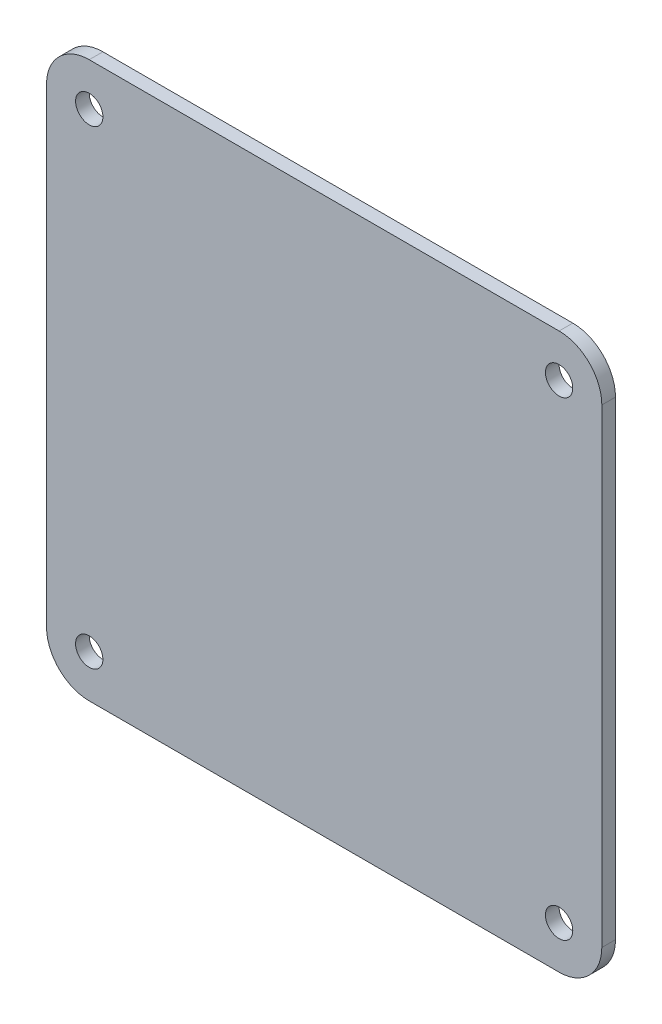
from build123d import *

# Parameters (mm, degrees)
SKETCH_1_W      = 65
SKETCH_1_H      = 65
SKETCH_1_R      = 1.6
EXTRUDE_1_DEPTH = 1.6
FILLET_1_R      = 5


with BuildPart() as part:
    # ｽｹｯﾁ1 → ﾎﾞｽ - 押し出し1 (new body)
    with BuildSketch(Plane.XY):
        Rectangle(SKETCH_1_W, SKETCH_1_H)
        with Locations((-27.5, 27.5)):
            Circle(SKETCH_1_R, mode=Mode.SUBTRACT)
        with Locations(Location((27.5, 27.5, 0), (0, 0, 180))):
            Circle(SKETCH_1_R, mode=Mode.SUBTRACT)
        with Locations(Location((-27.5, -27.5, 0), (0, 0, 180))):
            Circle(SKETCH_1_R, mode=Mode.SUBTRACT)
        with Locations((27.5, -27.5)):
            Circle(SKETCH_1_R, mode=Mode.SUBTRACT)
    extrude(amount=EXTRUDE_1_DEPTH)

    # ﾌｨﾚｯﾄ1
    fillet_1_edges = [part.edges().sort_by_distance(p)[0] for p in [
        (-32.5, 32.5, 0.8),
        (32.5, 32.5, 0.8),
        (32.5, -32.5, 0.8),
        (-32.5, -32.5, 0.8),
    ]]
    fillet(fillet_1_edges, radius=FILLET_1_R)


solid = part.part
